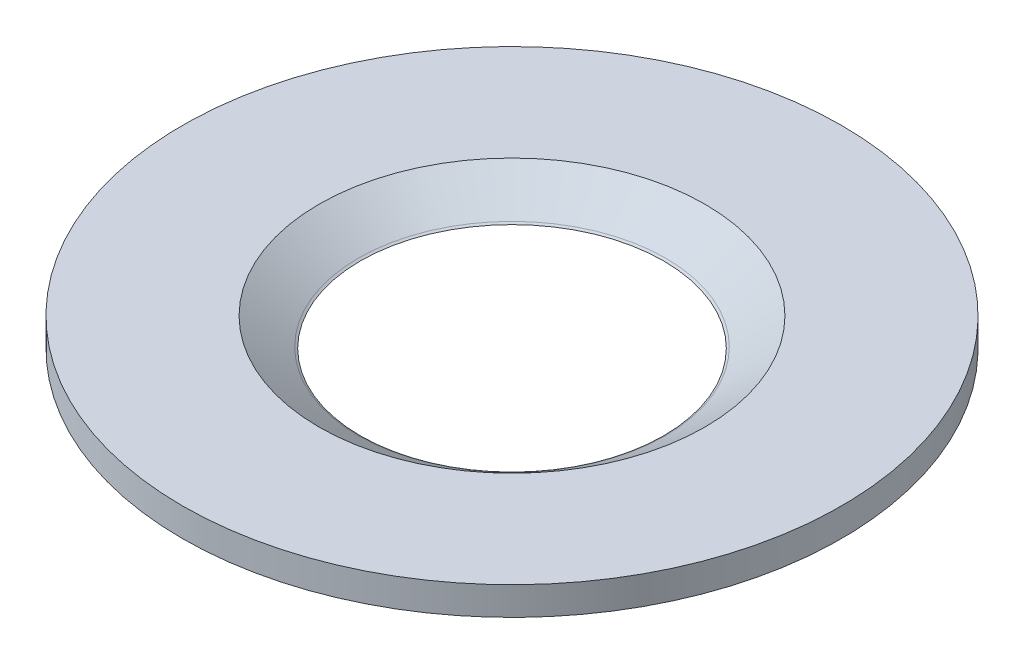
from build123d import *


with BuildPart() as part:
    # Sk_washer_section → Rev_washer (revolve)
    with BuildSketch(Plane.XY, mode=Mode.PRIVATE) as rev_washer_sk:
        with BuildLine():
            Line((10.1854, 62.5856), (22.1488, 62.5856))
            Line((22.1488, 62.5856), (22.1488, 64.4906))
            Line((22.1488, 64.4906), (12.97178, 64.4906))
            Line((12.97178, 64.4906), (10.32764, 62.6745))
            ThreePointArc((10.32764, 62.6745), (10.257684982, 62.62818603), (10.1854, 62.5856))
        make_face()
    revolve(rev_washer_sk.sketch.rotate(Axis((0, -25.4, 0), (0, 1, 0)), 90), axis=Axis((0, -25.4, 0), (0, 1, 0)))


solid = part.part
